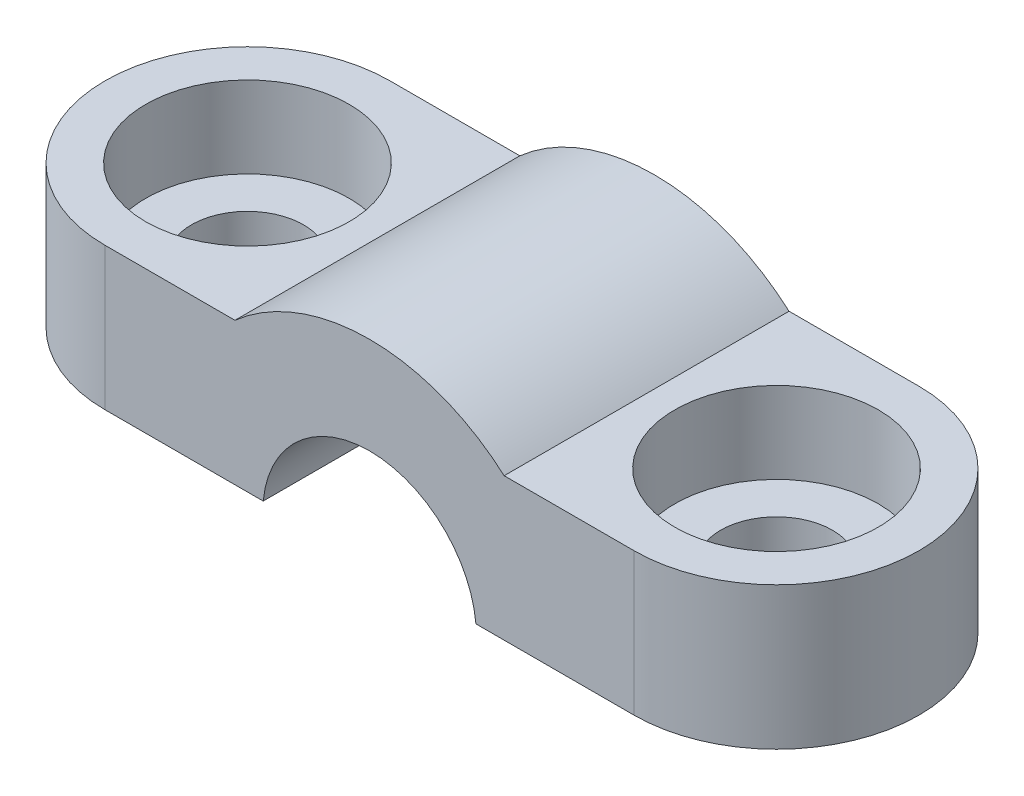
from build123d import *

# Parameters (mm, degrees)
BOSS_EXTRUDE1_DEPTH = 7
SKETCH2_R           = 2.75
CUT_EXTRUDE1_DEPTH  = 26.396850198
SKETCH3_R           = 5
CUT_EXTRUDE2_DEPTH  = 4
SKETCH4_R           = 5.25
CUT_EXTRUDE3_DEPTH  = 26.396850198
BOSS_EXTRUDE2_DEPTH = 14


with BuildPart() as part:
    # Sketch1 → Boss-Extrude1 (new body)
    with BuildSketch(Plane(origin=(0, 0, 0), x_dir=(1, 0, 0), z_dir=(0, 1, 0))):
        with BuildLine():
            Line((-13, 0), (13, 0))
            ThreePointArc((13, 0), (20, 7), (13, 14))
            Line((13, 14), (-13, 14))
            ThreePointArc((-13, 14), (-20, 7), (-13, 0))
        make_face()
    extrude(amount=BOSS_EXTRUDE1_DEPTH)

    # Sketch2 → Cut-Extrude1 (cut, through all)
    with BuildSketch(Plane(origin=(0, 7, 0), x_dir=(1, 0, 0), z_dir=(0, 1, 0))):
        with Locations(Location((-13, 7, 0), (0, 0, 270))):
            Circle(SKETCH2_R)
        with Locations(Location((13, 7, 0), (0, 0, 90))):
            Circle(SKETCH2_R)
    extrude(amount=-CUT_EXTRUDE1_DEPTH, mode=Mode.SUBTRACT)

    # Sketch3 → Cut-Extrude2 (cut)
    with BuildSketch(Plane(origin=(0, 7, 0), x_dir=(1, 0, 0), z_dir=(0, 1, 0))):
        with Locations(Location((-13, 7, 0), (0, 0, 270))):
            Circle(SKETCH3_R)
        with Locations(Location((13, 7, 0), (0, 0, 90))):
            Circle(SKETCH3_R)
    extrude(amount=-CUT_EXTRUDE2_DEPTH, mode=Mode.SUBTRACT)

    # Sketch4 → Cut-Extrude3 (cut, through all)
    with BuildSketch(Plane.XY):
        with Locations((0, -0.5)):
            Circle(SKETCH4_R)
    extrude(amount=-CUT_EXTRUDE3_DEPTH, mode=Mode.SUBTRACT)

    # Sketch5 → Boss-Extrude2 (add)
    with BuildSketch(Plane.XY):
        with BuildLine():
            Line((-6.614378278, 7), (6.614378278, 7))
            ThreePointArc((6.614378278, 7), (0, 9.5), (-6.614378278, 7))
        make_face()
    extrude(amount=-BOSS_EXTRUDE2_DEPTH)


solid = part.part
